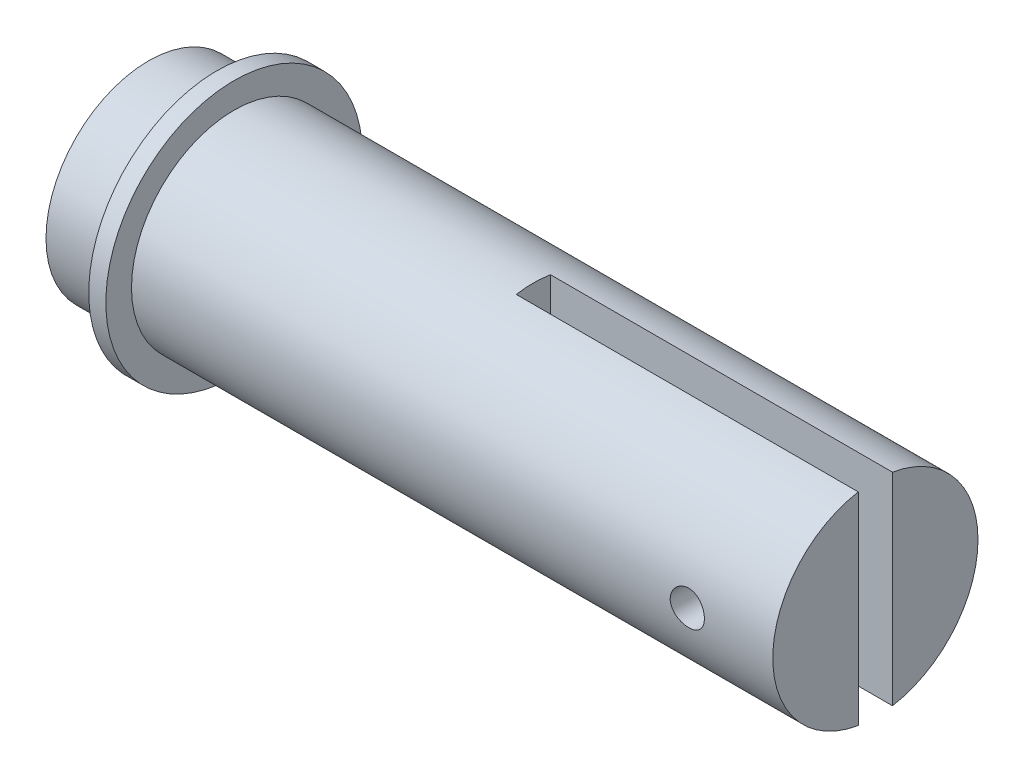
from build123d import *

# Parameters (mm, degrees)
EXTRUDE_1_DEPTH          = 80
EXTRUDE_1_DEPTH_BACK     = 5
SKETCH_2_R               = 12
SKETCH_1_R               = 2
CUT_EXTRUDE_1_DEPTH      = 80
SKETCH_4_R               = 15
EXTRUDE_2_DEPTH          = 2
CUT_EXTRUDE_START        = -40
CUT_EXTRUDE_2_DEPTH      = 40
CUT_EXTRUDE_3_DEPTH      = 40
CUT_EXTRUDE_3_DEPTH_BACK = 40
SKETCH_8_R               = 2
SKETCH_10_R              = 1
CUT_EXTRUDE_4_DEPTH      = 83.764726883


with BuildPart() as part:
    # 草图2 → 凸台-拉伸1 (new, two sides: drawn at the far end of the back side and taken through both)
    with BuildSketch(Plane(origin=(0, 0, 0), x_dir=(0, 0, -1), z_dir=(1, 0, 0)).offset(-EXTRUDE_1_DEPTH_BACK)):
        Circle(SKETCH_2_R)
    extrude(amount=EXTRUDE_1_DEPTH + EXTRUDE_1_DEPTH_BACK)

    # 草图1 → 切除-拉伸1 (cut)
    with BuildSketch(Plane(origin=(0, 0, 0), x_dir=(1, 0, 0), z_dir=(0, 1, 0))):
        with Locations(Location((0, 0, 0), (0, 0, 270))):
            Circle(SKETCH_1_R)
    extrude(amount=-CUT_EXTRUDE_1_DEPTH, mode=Mode.SUBTRACT)

    # 草图4 → 凸台-拉伸2 (add)
    with BuildSketch(Plane(origin=(5, 0, 0), x_dir=(0, 0, -1), z_dir=(1, 0, 0))):
        Circle(SKETCH_4_R)
    extrude(amount=-EXTRUDE_2_DEPTH)

    # 草图7 → 切除-拉伸2 (cut)
    with BuildSketch(Plane(origin=(80, 0, 0), x_dir=(0, 0, -1), z_dir=(1, 0, 0)).offset(CUT_EXTRUDE_START)):
        with BuildLine():
            ThreePointArc((2, 11.832159566), (0, 12), (-2, 11.832159566))
            Line((-2, 11.832159566), (-2, -11.832159566))
            ThreePointArc((-2, -11.832159566), (0, -12), (2, -11.832159566))
            Line((2, -11.832159566), (2, 11.832159566))
        make_face()
    extrude(amount=CUT_EXTRUDE_2_DEPTH, mode=Mode.SUBTRACT)

    # 草图8 → 切除-拉伸3 (cut, two sides: drawn at the far end of the back side and taken through both)
    with BuildSketch(Plane.XY.offset(-2).offset(-CUT_EXTRUDE_3_DEPTH_BACK)):
        with Locations(Location((70, 0, 0), (0, 0, 180))):
            Circle(SKETCH_8_R)
    extrude(amount=CUT_EXTRUDE_3_DEPTH + CUT_EXTRUDE_3_DEPTH_BACK, mode=Mode.SUBTRACT)

    # 草图10 → 切除-拉伸4 (cut, through all)
    with BuildSketch(Plane(origin=(0, 0, 0), x_dir=(0, 0, -1), z_dir=(1, 0, 0))):
        with Locations((0, -8)):
            Circle(SKETCH_10_R)
    extrude(amount=-CUT_EXTRUDE_4_DEPTH, mode=Mode.SUBTRACT)


solid = part.part
